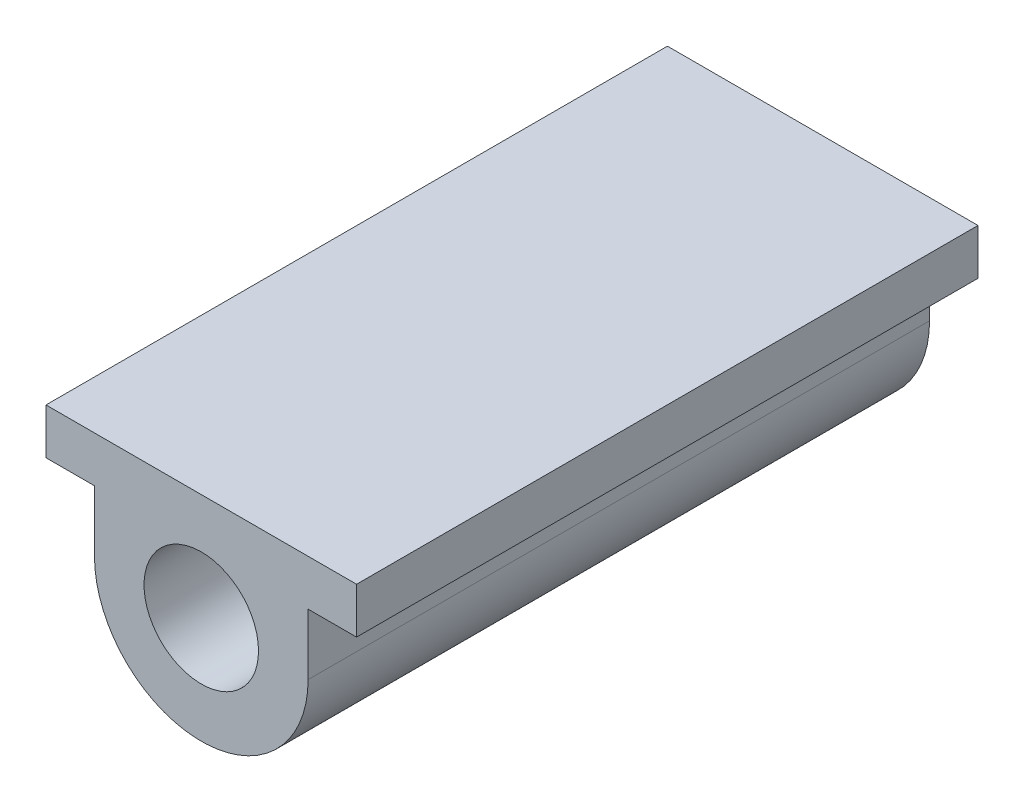
from build123d import *

# Parameters (mm, degrees)
SKETCH1_R           = 7.5
BOSS_EXTRUDE1_DEPTH = 81.44


with BuildPart() as part:
    # Sketch1 → Boss-Extrude1 (new body)
    with BuildSketch(Plane.XY):
        with BuildLine():
            Line((-20.35, 14), (20.35, 14))
            Line((20.35, 14), (20.35, 8))
            Line((20.35, 8), (14, 8))
            Line((14, 8), (14, 0))
            ThreePointArc((14, 0), (0, -14), (-14, 0))
            Line((-14, 0), (-14, 8))
            Line((-14, 8), (-20.35, 8))
            Line((-20.35, 8), (-20.35, 14))
        make_face()
        Circle(SKETCH1_R, mode=Mode.SUBTRACT)
    extrude(amount=BOSS_EXTRUDE1_DEPTH)


solid = part.part
